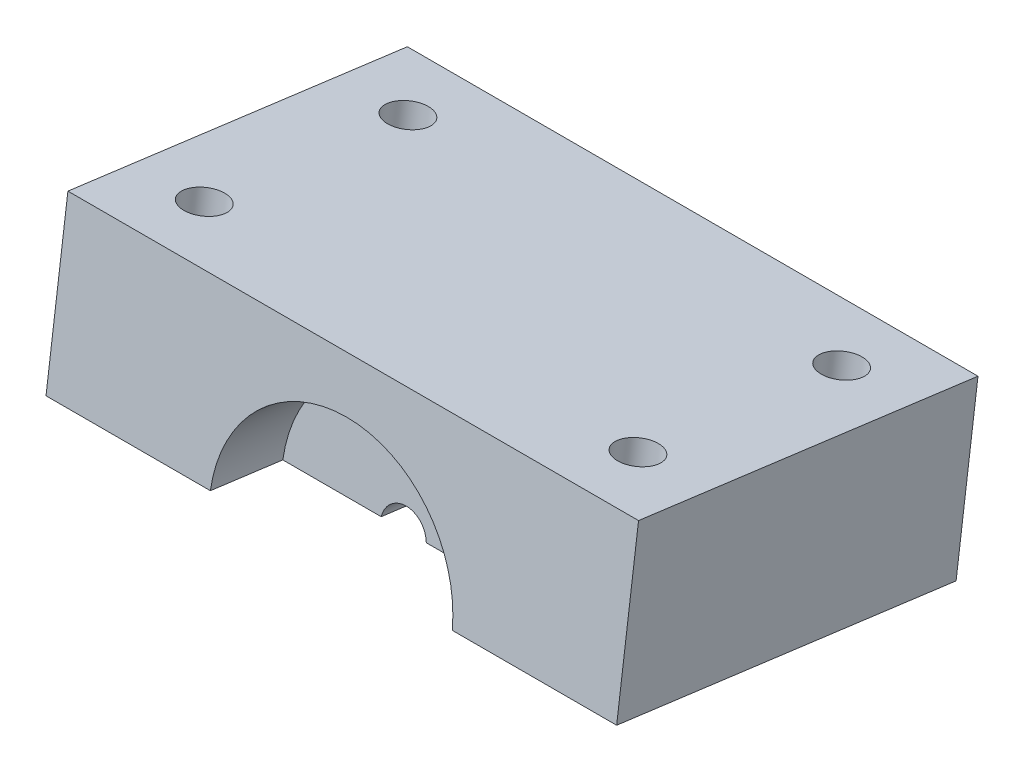
from build123d import *

# Parameters (mm, degrees)
EXTRUDE_TOP_BLOCK_DEPTH             = 75
CUT_EXTRUDE_BOLT_PATTERN_DEPTH      = 108.574034239
CUT_EXTRUDE_BOLT_PATTERN_DEPTH_BACK = 108.574034239
SKETCH2_R                           = 2.75
EXTRUDE_START                       = -16
EXTRUDE_ADDITION_MATERIAL_DEPTH     = 59
CUT_EXTRUDE_SHAFT_PATHWAY_REACH     = 99.296
SKETCH7_R                           = 2
CUT_EXTRUDE1_DEPTH                  = 25
SKETCH8_R                           = 4.5
CUT_EXTRUDE2_DEPTH                  = 6


with BuildPart() as part:
    # Sketch1 → Extrude Top Block (new body)
    with BuildSketch(Plane(origin=(0, 0, 0), x_dir=(1, 0, 0), z_dir=(0, 0.13052619222003847, 0.9914448613738122))):
        with BuildLine():
            Line((62.5, 0.75), (62.5, 37.5))
            Line((62.5, 37.5), (-62.5, 37.5))
            Line((-62.5, 37.5), (-62.5, 0.75))
            Line((-62.5, 0.75), (-26.489384666, 0.75))
            ThreePointArc((-26.489384666, 0.75), (0, 26.5), (26.489384666, 0.75))
            Line((26.489384666, 0.75), (62.5, 0.75))
        make_face()
    extrude(amount=-EXTRUDE_TOP_BLOCK_DEPTH)

    # Sketch2 → Cut-Extrude Bolt Pattern (cut, two sides: drawn at the far end of the back side and taken through both)
    with BuildSketch(Plane(origin=(0, 37.179182302, -4.894732208), x_dir=(1, 0, 0), z_dir=(0, 0.9914448613738122, -0.13052619222003847)).offset(-CUT_EXTRUDE_BOLT_PATTERN_DEPTH_BACK)):
        with Locations(Location((-47.5, 15, 0), (0, 0, 270))):
            Circle(SKETCH2_R)
        with Locations(Location((-47.5, 60, 0), (0, 0, 270))):
            Circle(SKETCH2_R)
        with Locations(Location((47.5, 15, 0), (0, 0, 270))):
            Circle(SKETCH2_R)
        with Locations(Location((47.5, 60, 0), (0, 0, 270))):
            Circle(SKETCH2_R)
    extrude(amount=CUT_EXTRUDE_BOLT_PATTERN_DEPTH + CUT_EXTRUDE_BOLT_PATTERN_DEPTH_BACK, mode=Mode.SUBTRACT)

    # Sketch4 → Extrude Addition Material (add)
    with BuildSketch(Plane(origin=(0, 0, 0), x_dir=(1, 0, 0), z_dir=(0, 0.13052619222003847, 0.9914448613738122)).offset(EXTRUDE_START)):
        with BuildLine():
            Line((-26.489384666, 0.75), (26.489384666, 0.75))
            ThreePointArc((26.489384666, 0.75), (0, 26.5), (-26.489384666, 0.75))
        make_face()
    extrude(amount=-EXTRUDE_ADDITION_MATERIAL_DEPTH)

    # Sketch3 → Cut-Extrude Seat for Linear Bearing (revolve, cut)
    with BuildSketch(Plane(origin=(0, 0, 0), x_dir=(0, 0, -1), z_dir=(1, 0, 0))):
        Polygon((41.497659566, 1.092817718), (61.326556793, -1.517706126), (60.478136544, -7.962097725), (40.649239316, -5.351573881), align=None)
    revolve(axis=Axis((0, 0, 0), (0, -0.1305261922200383, -0.9914448613738122)), mode=Mode.SUBTRACT)

    # Cut-Extrude Shaft Pathway: up to this face of the body (flat: up to its plane)
    cut_extrude_shaft_pathway_end = Plane(part.part.faces().sort_by_distance((0, 9.171918557, -76.854678029))[0])
    # Sketch6 → Cut-Extrude Shaft Pathway (cut, up to the picked face)
    with BuildSketch(Plane(origin=(0, -2.088419076, -15.863117782), x_dir=(1, 0, 0), z_dir=(0, 0.13052619222003847, 0.9914448613738122)), mode=Mode.PRIVATE) as cut_extrude_shaft_pathway_sk1:
        with BuildLine():
            Line((-4.943429983, 0.75), (4.943429983, 0.75))
            ThreePointArc((4.943429983, 0.75), (0, 5), (-4.943429983, 0.75))
        make_face()
    cut_extrude_shaft_pathway_tool1 = split(extrude(cut_extrude_shaft_pathway_sk1.sketch, amount=-CUT_EXTRUDE_SHAFT_PATHWAY_REACH, mode=Mode.PRIVATE), bisect_by=cut_extrude_shaft_pathway_end, keep=Keep.BOTH, mode=Mode.PRIVATE)
    add(cut_extrude_shaft_pathway_tool1.solids().sort_by(Axis((0, 0.422663, -16.193708), (0, -0.13052619222003847, -0.9914448613738122)))[0], mode=Mode.SUBTRACT)

    # Sketch7 → Cut-Extrude1 (cut)
    with BuildSketch(Plane(origin=(0, -9.789464417, -74.358364603), x_dir=(-1, 0, 0), z_dir=(0, -0.13052619222003847, -0.9914448613738122))):
        with Locations(Location((-20, 20, 0), (0, 0, 90))):
            Circle(SKETCH7_R)
        with Locations(Location((20, 20, 0), (0, 0, 90))):
            Circle(SKETCH7_R)
    extrude(amount=-CUT_EXTRUDE1_DEPTH, mode=Mode.SUBTRACT)

    # Sketch8 → Cut-Extrude2 (cut)
    with BuildSketch(Plane(origin=(0, 37.179182302, -4.894732208), x_dir=(1, 0, 0), z_dir=(0, 0.9914448613738122, -0.13052619222003847))):
        with Locations(Location((47.5, 15, 0), (0, 0, 270))):
            Circle(SKETCH8_R)
        with Locations(Location((47.5, 60, 0), (0, 0, 270))):
            Circle(SKETCH8_R)
        with Locations(Location((-47.5, 15, 0), (0, 0, 270))):
            Circle(SKETCH8_R)
        with Locations(Location((-47.5, 60, 0), (0, 0, 270))):
            Circle(SKETCH8_R)
    extrude(amount=-CUT_EXTRUDE2_DEPTH, mode=Mode.SUBTRACT)


solid = part.part
